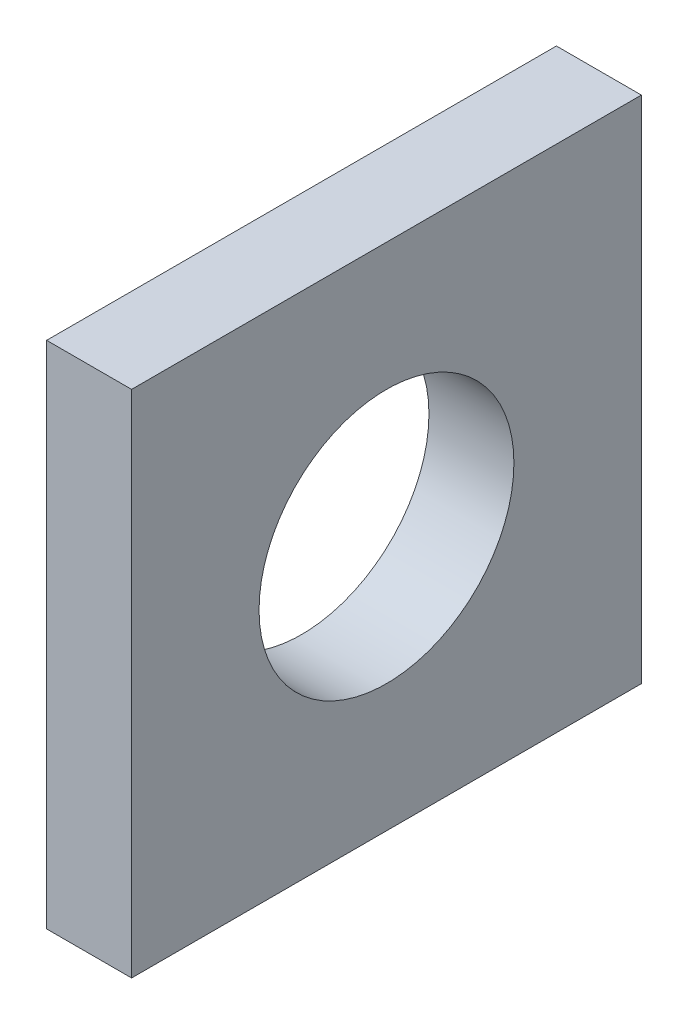
from build123d import *

# Parameters (mm, degrees)
SKETCH1_W           = 19.05
SKETCH1_H           = 19.05
SKETCH1_R           = 4.7625
BOSS_EXTRUDE1_DEPTH = 3.175


with BuildPart() as part:
    # Sketch1 → Boss-Extrude1 (new body)
    with BuildSketch(Plane(origin=(0, 0, 0), x_dir=(0, 0, -1), z_dir=(1, 0, 0))):
        Rectangle(SKETCH1_W, SKETCH1_H)
        Circle(SKETCH1_R, mode=Mode.SUBTRACT)
    extrude(amount=BOSS_EXTRUDE1_DEPTH)


solid = part.part
